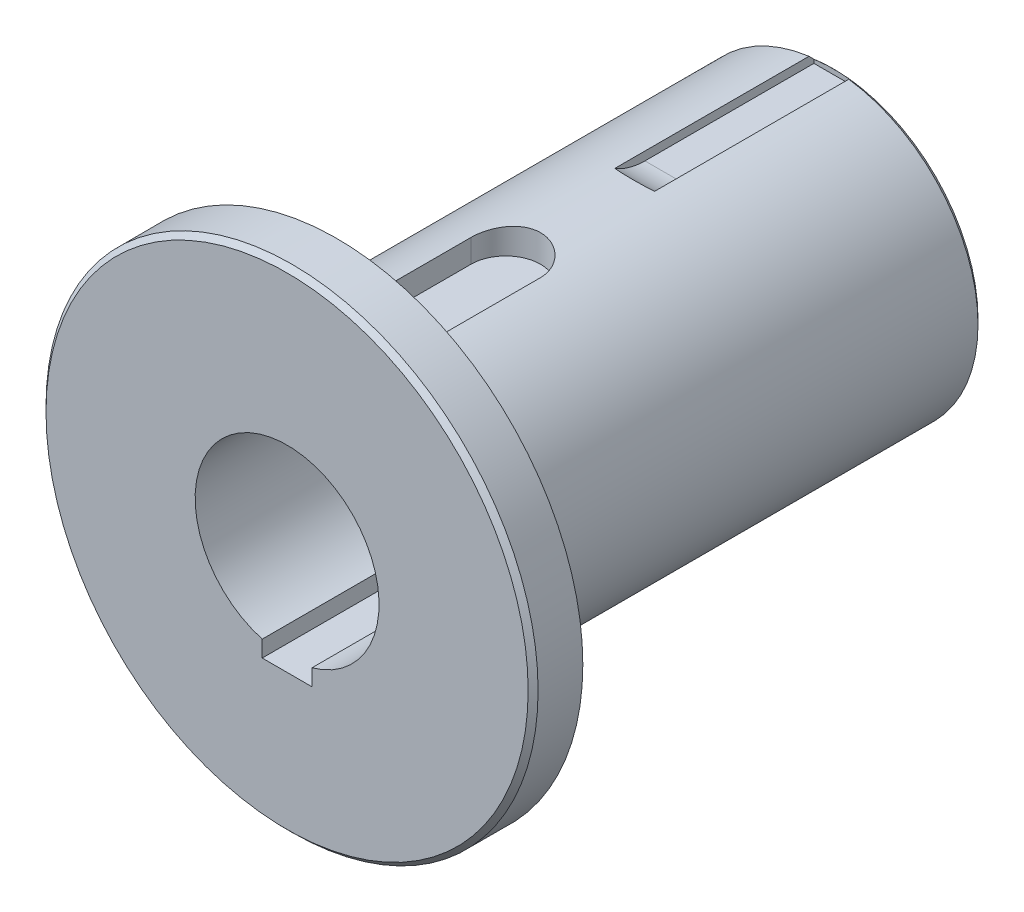
from build123d import *

# Parameters (mm, degrees)
TAGLIO_ESTRUSIONE1_DEPTH = 131.385965502
TAGLIO_ESTRUSIONE5_DEPTH = 5.5
SMUSSO1_SIZE             = 1
TAGLIO_ESTRUSIONE6_DEPTH = 4


with BuildPart() as part:
    # Schizzo1 → Rivoluzione1 (revolve)
    with BuildSketch(Plane(origin=(0, 0, 0), x_dir=(0, 0, -1), z_dir=(1, 0, 0)), mode=Mode.PRIVATE) as rivoluzione1_sk:
        Polygon((-49.566192487, 49.5), (-39.566192487, 49.5), (-39.566192487, 30), (60.433807513, 30), (60.433807513, 18.5), (-49.566192487, 18.5), align=None)
    revolve(rivoluzione1_sk.sketch.rotate(Axis((0, 0, 106.615161212), (0, 0, -1)), 90), axis=Axis((0, 0, 106.615161212), (0, 0, -1)))

    # Schizzo2 → Taglio-Estrusione1 (cut, through all)
    with BuildSketch(Plane(origin=(0, 0, -60.433807513), x_dir=(-1, 0, 0), z_dir=(0, 0, -1))):
        with BuildLine():
            ThreePointArc((0, -18.5), (-2.523589416, -18.327070046), (-5, -17.811513131))
            Line((-5, -17.811513131), (-5, -21.111513131))
            Line((-5, -21.111513131), (0, -21.111513131))
            Line((0, -21.111513131), (0, -18.5))
        make_face()
        with BuildLine():
            ThreePointArc((5, -17.811513131), (2.523589416, -18.327070046), (0, -18.5))
            Line((0, -18.5), (0, -21.111513131))
            Line((0, -21.111513131), (5, -21.111513131))
            Line((5, -21.111513131), (5, -17.811513131))
        make_face()
    extrude(amount=-TAGLIO_ESTRUSIONE1_DEPTH, mode=Mode.SUBTRACT)

    # Schizzo5 → Taglio-Estrusione5 (cut)
    with BuildSketch(Plane(origin=(0, 30, 0), x_dir=(-1, 0, 0), z_dir=(0, -1, 0))):
        with BuildLine():
            Line((7, -5.566192487), (7, -27.566192487))
            ThreePointArc((7, -27.566192487), (0, -34.566192487), (-7, -27.566192487))
            Line((-7, -27.566192487), (-7, -5.566192487))
            ThreePointArc((-7, -5.566192487), (0, 1.433807513), (7, -5.566192487))
        make_face()
    extrude(amount=TAGLIO_ESTRUSIONE5_DEPTH, mode=Mode.SUBTRACT)

    # Smusso1
    smusso1_edges = [part.edges().sort_by_distance(p)[0] for p in [
        (-30, 0, -60.433807513),
        (-49.5, 0, 49.566192487),
    ]]
    chamfer(smusso1_edges, length=SMUSSO1_SIZE)

    # Schizzo7 → Taglio-Estrusione6 (cut, symmetric)
    with BuildSketch(Plane(origin=(0, 0, 0), x_dir=(0, 0, -1), z_dir=(1, 0, 0))):
        with BuildLine():
            Line((26.433807513, 51), (60.190248372, 51))
            Line((60.190248372, 51), (60.422535475, 28))
            Line((60.422535475, 28), (26.433807513, 28))
            ThreePointArc((26.433807513, 28), (14.933807513, 39.5), (26.433807513, 51))
        make_face()
    extrude(amount=TAGLIO_ESTRUSIONE6_DEPTH, both=True, mode=Mode.SUBTRACT)


solid = part.part
